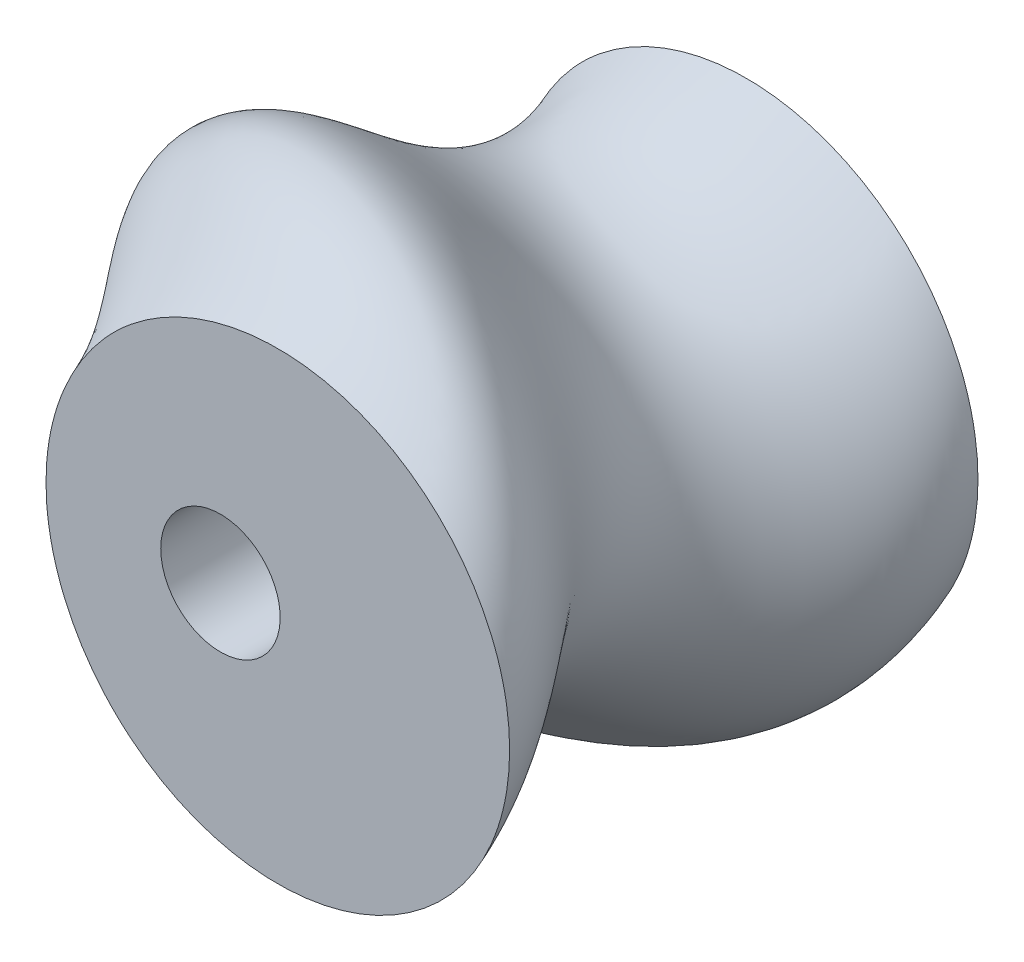
from build123d import *

# Parameters (mm, degrees)
AUSTRAGUNG1_PITCH               = 20
AUSTRAGUNG1_HEIGHT              = 20
AUSTRAGUNG1_RADIUS              = 2.55
SKIZZE2_R                       = 9.89957
SKIZZE3_2_R                     = 2.55
SCHNITT_LINEAR_AUSTRAGEN2_DEPTH = 27


with BuildPart() as part:
    # Austragung1: sweep along a helix
    with BuildLine() as austragung1_path:
        Helix(AUSTRAGUNG1_PITCH, AUSTRAGUNG1_HEIGHT, AUSTRAGUNG1_RADIUS, center=(-2.45, 0, 0), direction=(0, 0, 1), lefthand=True)
    # Skizze2 → Austragung1 (sweep)
    with BuildSketch(Plane.XY):
        Circle(SKIZZE2_R)
    sweep(path=austragung1_path.line, is_frenet=True)

    # Skizze3<2> → Schnitt-Linear austragen2 (cut)
    with BuildSketch(Plane.XY):
        with Locations(Location((-2.45, 0, 0), (0, 0, 180))):
            Circle(SKIZZE3_2_R)
    extrude(amount=SCHNITT_LINEAR_AUSTRAGEN2_DEPTH, mode=Mode.SUBTRACT)


solid = part.part
